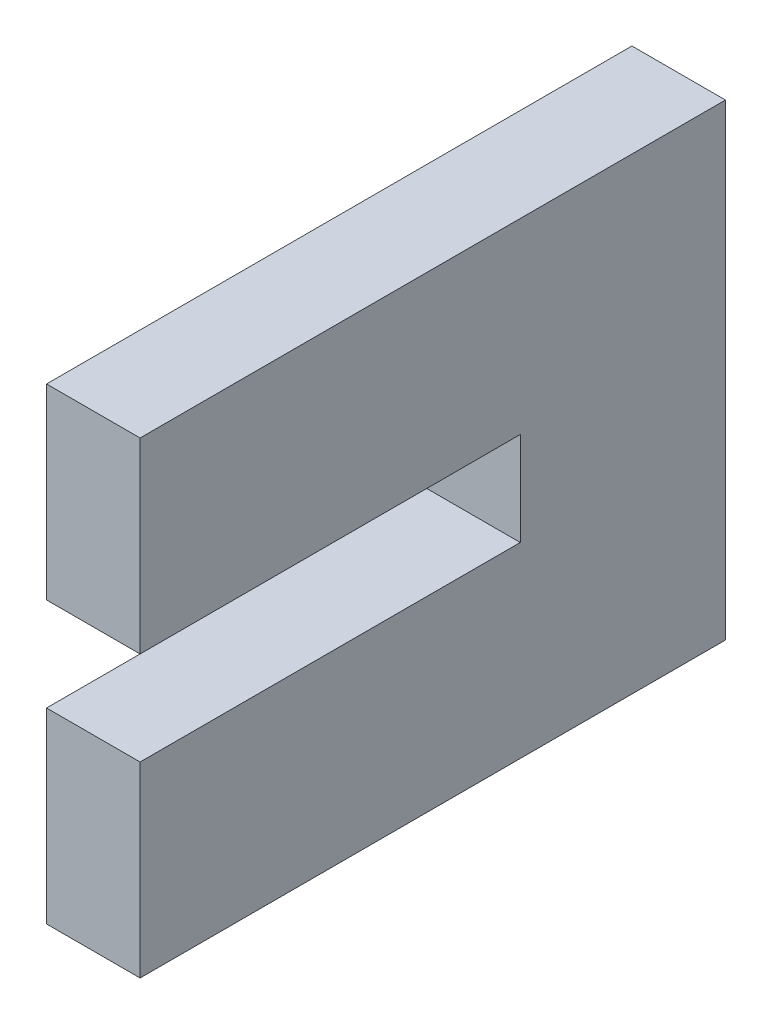
from build123d import *

# Parameters (mm, degrees)
BOSS_EXTRUDE1_DEPTH = 4


with BuildPart() as part:
    # Sketch1 → Boss-Extrude1 (new, symmetric)
    with BuildSketch(Plane(origin=(0, 0, 0), x_dir=(0, 0, -1), z_dir=(1, 0, 0))):
        Polygon((36.258064516, 20), (36.258064516, -20), (-13.806451613, -20), (-13.806451613, -4), (18.709677419, -4), (18.709677419, 4), (-13.806451613, 4), (-13.806451613, 20), align=None)
    extrude(amount=BOSS_EXTRUDE1_DEPTH, both=True)


solid = part.part
